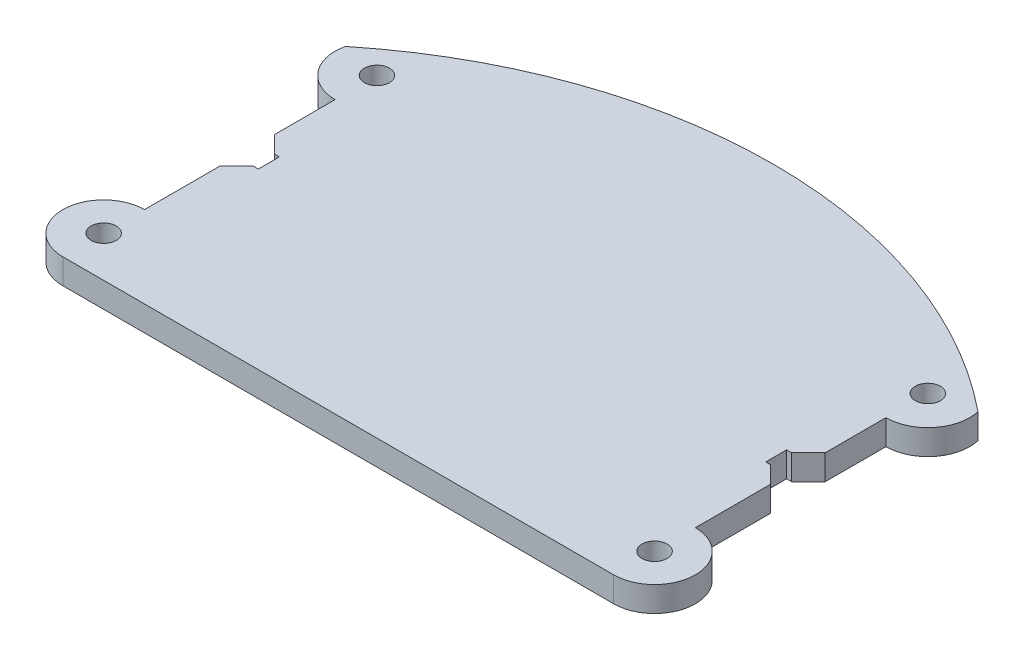
from build123d import *

# Parameters (mm, degrees)
CROQUIS1_R              = 1.5
SALIENTE_EXTRUIR1_DEPTH = 3


with BuildPart() as part:
    # Croquis1 → Saliente-Extruir1 (new body)
    with BuildSketch(Plane(origin=(0, 0, 0), x_dir=(1, 0, 0), z_dir=(0, 1, 0))):
        with BuildLine():
            Line((-32.89, -7.25), (-32.89, 0.008962831))
            Line((-32.89, 0.008962831), (-32.892040435, 0.008962415))
            ThreePointArc((-32.892040435, 0.008962415), (-36.801169554, 1.891477927), (-37.766700191, 6.121478601))
            ThreePointArc((-37.766700191, 6.121478601), (0, 19.498776441), (37.766700191, 6.121478601))
            ThreePointArc((37.766700191, 6.121478601), (36.801169554, 1.891477927), (32.892040435, 0.008962415))
            Line((32.892040435, 0.008962415), (32.89, 0.008962831))
            Line((32.89, 0.008962831), (32.89, -7.25))
            Line((32.89, -7.25), (30.89, -9.25))
            Line((30.89, -9.25), (30.29, -9.25))
            Line((30.29, -9.25), (30.29, -11.749506691))
            Line((30.29, -11.749506691), (30.89, -11.749506691))
            Line((30.89, -11.749506691), (32.89, -13.749506691))
            Line((32.89, -13.749506691), (32.89, -22.746599618))
            ThreePointArc((32.89, -22.746599618), (37.766700191, -27.623299809), (32.89, -32.5))
            Line((32.89, -32.5), (-32.89, -32.5))
            ThreePointArc((-32.89, -32.5), (-37.766700191, -27.623299809), (-32.89, -22.746599618))
            Line((-32.89, -22.746599618), (-32.89, -13.749506691))
            Line((-32.89, -13.749506691), (-30.89, -11.749506691))
            Line((-30.89, -11.749506691), (-30.29, -11.749506691))
            Line((-30.29, -11.749506691), (-30.29, -9.25))
            Line((-30.29, -9.25), (-30.89, -9.25))
            Line((-30.89, -9.25), (-32.89, -7.25))
        make_face()
        with Locations(Location((-32.892040435, 5.008962415, 0), (0, 0, 270))):
            Circle(CROQUIS1_R, mode=Mode.SUBTRACT)
        with Locations(Location((32.89, 5.008962415, 0), (0, 0, 270))):
            Circle(CROQUIS1_R, mode=Mode.SUBTRACT)
        with Locations(Location((-32.89, -27.623299809, 0), (0, 0, 270))):
            Circle(CROQUIS1_R, mode=Mode.SUBTRACT)
        with Locations(Location((32.89, -27.623299809, 0), (0, 0, 270))):
            Circle(CROQUIS1_R, mode=Mode.SUBTRACT)
    extrude(amount=SALIENTE_EXTRUIR1_DEPTH)


solid = part.part
